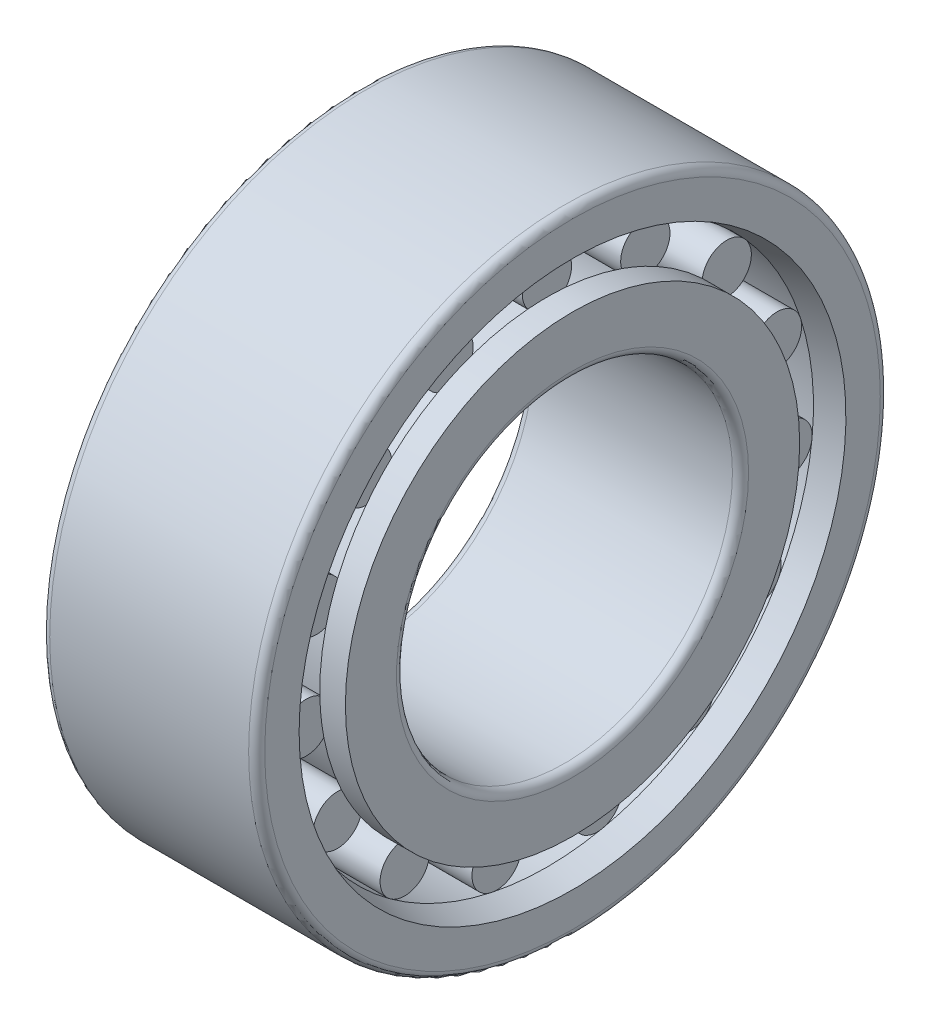
from build123d import *

# Parameters (mm, degrees)
SKETCH_4_W               = 4.571428571
SKETCH_4_H               = 1.834333333
SKETCH_5_W               = 4.571428571
SKETCH_5_H               = 1.834333333
PATTERN_CIRCULAR_1_COUNT = 15


with BuildPart() as part:
    # 草图1 → Revolve 982 (revolve)
    with BuildSketch(Plane.XY, mode=Mode.PRIVATE) as revolve_982_sk:
        with BuildLine():
            Line((0.6, 23.5), (15.4, 23.5))
            ThreePointArc((15.4, 23.5), (15.824264069, 23.324264069), (16, 22.9))
            Line((16, 22.9), (16, 20.343712747))
            Line((16, 20.343712747), (14.095238095, 19.833333333))
            Line((14.095238095, 19.833333333), (1.904761905, 19.833333333))
            Line((1.904761905, 19.833333333), (0, 20.343712747))
            Line((0, 20.343712747), (0, 22.9))
            ThreePointArc((0, 22.9), (0.175735931, 23.324264069), (0.6, 23.5))
        make_face()
    revolve(revolve_982_sk.sketch.rotate(Axis((0, 0, 0), (1, 0, 0)), 90), axis=Axis((0, 0, 0), (1, 0, 0)))

    # 草图4 → 凸台-旋转1 (revolve)
    with BuildSketch(Plane.XY):
        with Locations((4.190476191, 18.917166667)):
            Rectangle(SKETCH_4_W, SKETCH_4_H)
    revolve_1 = revolve(axis=Axis((-94.048758784, 18, 0), (1, 0, 0)))

    # 草图5 → 凸台-旋转2 (revolve)
    with BuildSketch(Plane.XY):
        with Locations((11.809523809, 18.917166667)):
            Rectangle(SKETCH_5_W, SKETCH_5_H)
    revolve_2 = revolve(axis=Axis((-94.048758784, 18, 0), (1, 0, 0)))

    # 草图2 → 凸台-旋转3 (revolve)
    with BuildSketch(Plane.XY, mode=Mode.PRIVATE) as revolve_3_sk:
        with BuildLine():
            Line((14.095238095, 16.166666667), (14.095238095, 16.9))
            Line((14.095238095, 16.9), (16, 16.9))
            Line((16, 16.9), (16, 13.1))
            ThreePointArc((16, 13.1), (15.824264069, 12.675735931), (15.4, 12.5))
            Line((15.4, 12.5), (0.6, 12.5))
            ThreePointArc((0.6, 12.5), (0.175735931, 12.675735931), (0, 13.1))
            Line((0, 13.1), (0, 16.9))
            Line((0, 16.9), (1.904761905, 16.9))
            Line((1.904761905, 16.9), (1.904761905, 16.166666667))
            Line((1.904761905, 16.166666667), (6.476190476, 16.166666667))
            Line((6.476190476, 16.166666667), (6.476190476, 16.9))
            Line((6.476190476, 16.9), (9.523809524, 16.9))
            Line((9.523809524, 16.9), (9.523809524, 16.166666667))
            Line((9.523809524, 16.166666667), (14.095238095, 16.166666667))
        make_face()
    revolve(revolve_3_sk.sketch.rotate(Axis((0, 0, 0), (-1, 0, 0)), 90), axis=Axis((0, 0, 0), (-1, 0, 0)))

    # 阵列(圆周)1: 凸台-旋转1, 凸台-旋转2 ×15 about axis
    pattern_circular_1_axis = Axis((0, 0, 0), (1, 0, 0))
    add([revolve_1.rotate(pattern_circular_1_axis, i * 360 / PATTERN_CIRCULAR_1_COUNT) for i in range(1, PATTERN_CIRCULAR_1_COUNT)])
    add([revolve_2.rotate(pattern_circular_1_axis, i * 360 / PATTERN_CIRCULAR_1_COUNT) for i in range(1, PATTERN_CIRCULAR_1_COUNT)])


solid = part.part
